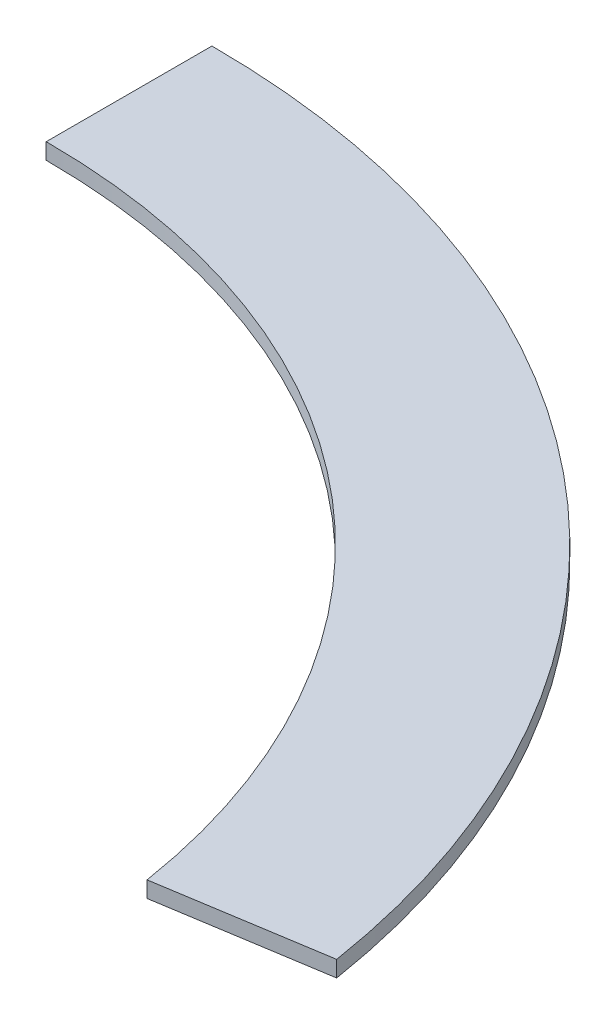
from build123d import *

# Parameters (mm, degrees)
BOSS_EXTRUDE1_DEPTH = 1
CUT_EXTRUDE2_DEPTH  = 79.106781766


with BuildPart() as part:
    # Sketch1 → Boss-Extrude1 (new body)
    with BuildSketch(Plane(origin=(0, 0, 0), x_dir=(1, 0, 0), z_dir=(0, 1, 0))):
        with BuildLine():
            Line((0, 43.251994239), (0, 55.567643532))
            ThreePointArc((0, 55.567643532), (36.081799937, 42.259516337), (54.880837731, 8.709572759))
            Line((54.880837731, 8.709572759), (42.717327117, 6.779747014))
            ThreePointArc((42.717327117, 6.779747014), (28.084670434, 32.893560042), (0, 43.251994239))
        make_face()
    extrude(amount=BOSS_EXTRUDE1_DEPTH)

    # Sketch3 → Cut-Extrude2 (cut, through all)
    with BuildSketch(Plane(origin=(0, 1, 0), x_dir=(1, 0, 0), z_dir=(0, 1, 0))):
        with BuildLine():
            ThreePointArc((0, 53.515035317), (34.74894502, 40.698523621), (52.853585963, 8.387935135))
            Line((52.853585963, 8.387935135), (54.880837731, 8.709572759))
            ThreePointArc((54.880837731, 8.709572759), (36.081799937, 42.259516337), (0, 55.567643532))
            Line((0, 55.567643532), (0, 53.515035317))
        make_face()
    extrude(amount=-CUT_EXTRUDE2_DEPTH, mode=Mode.SUBTRACT)


solid = part.part
